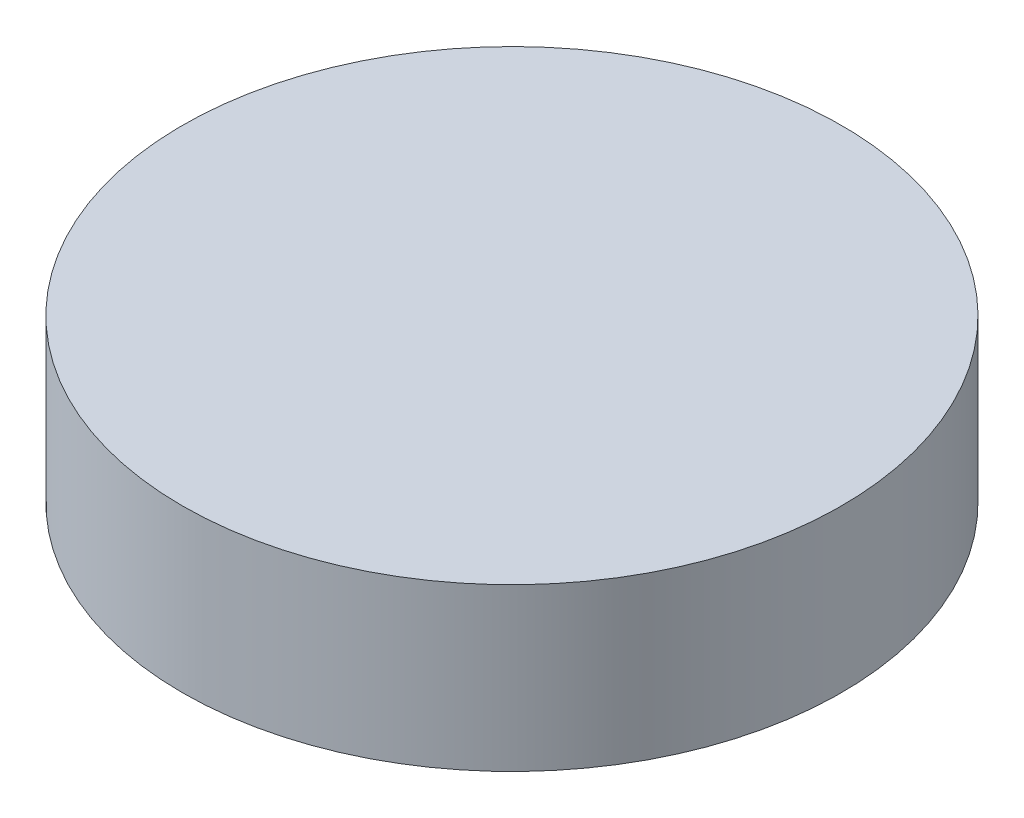
from build123d import *

# Parameters (mm, degrees)
SKETCH1_R           = 110
BOSS_EXTRUDE1_DEPTH = 54


with BuildPart() as part:
    # Sketch1 → Boss-Extrude1 (new body)
    with BuildSketch(Plane(origin=(0, 0, 0), x_dir=(1, 0, 0), z_dir=(0, 1, 0))):
        with Locations(Location((0, 0, 0), (0, 0, 270))):
            Circle(SKETCH1_R)
    extrude(amount=BOSS_EXTRUDE1_DEPTH)


solid = part.part
